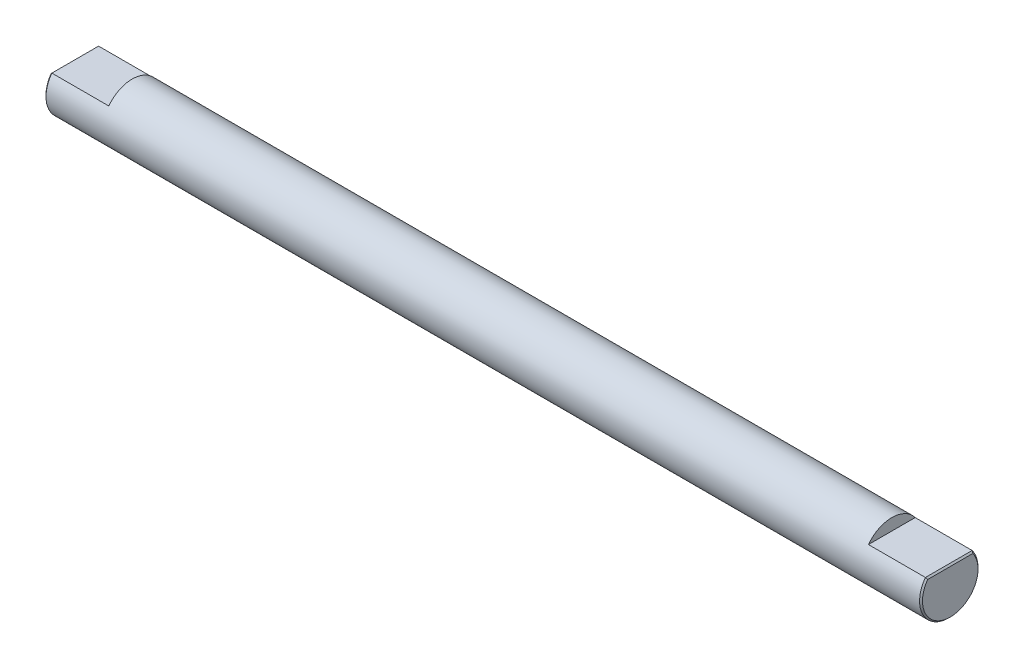
from build123d import *

# Parameters (mm, degrees)
SKETCH1_W               = 300
SKETCH1_H               = 10
CUT_EXTRUDE1_DEPTH      = 301.333148354
CUT_EXTRUDE1_DEPTH_BACK = 301.333148354
SKETCH2_W               = 20
SKETCH2_H               = 4
CHAMFER1_SIZE           = 0.5


with BuildPart() as part:
    # Sketch1 → Revolve1 (revolve)
    with BuildSketch(Plane.XY, mode=Mode.PRIVATE) as revolve1_sk:
        with Locations((150, 5)):
            Rectangle(SKETCH1_W, SKETCH1_H)
    revolve(revolve1_sk.sketch.rotate(Axis((0, 0, 0), (1, 0, 0)), 90), axis=Axis((0, 0, 0), (1, 0, 0)))

    # Sketch2 → Cut-Extrude1 (cut, two sides: drawn at the far end of the back side and taken through both)
    with BuildSketch(Plane.XY.offset(-CUT_EXTRUDE1_DEPTH_BACK)):
        with Locations((10, 8)):
            Rectangle(SKETCH2_W, SKETCH2_H)
        with Locations((290, 8)):
            Rectangle(SKETCH2_W, SKETCH2_H)
    extrude(amount=CUT_EXTRUDE1_DEPTH + CUT_EXTRUDE1_DEPTH_BACK, mode=Mode.SUBTRACT)

    # Chamfer1
    chamfer1_edges = [part.edges().sort_by_distance(p)[0] for p in [
        (0, 6, 0),
        (300, -9.486832981, -3.16227766),
        (300, 6, 0),
        (0, -9.486832981, -3.16227766),
    ]]
    chamfer(chamfer1_edges, length=CHAMFER1_SIZE)


solid = part.part
